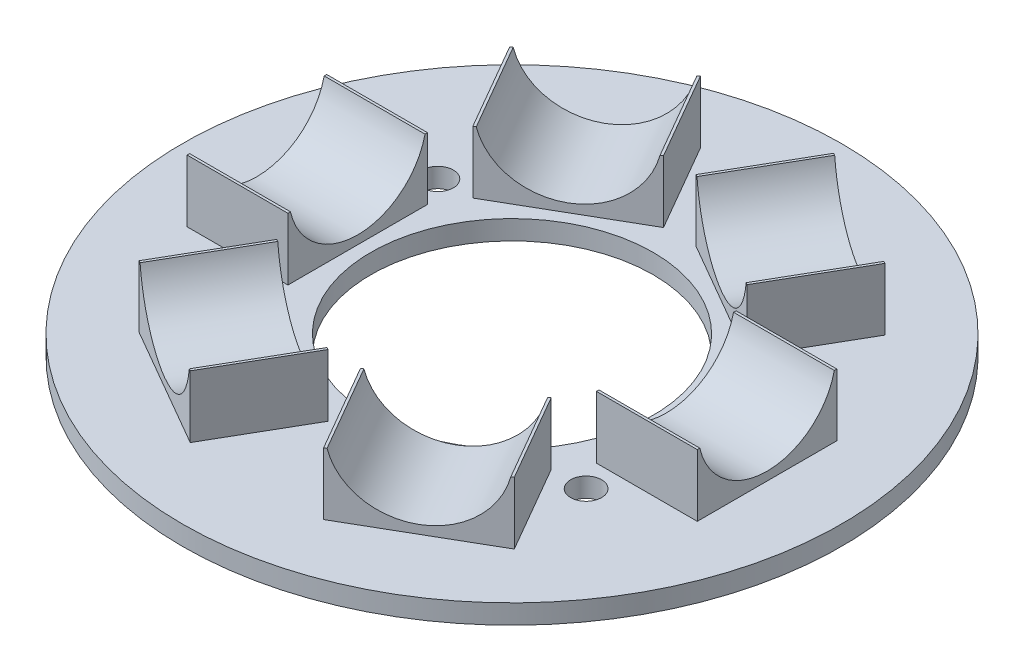
from build123d import *

# Parameters (mm, degrees)
SKETCH1_R           = 42.5
BOSS_EXTRUDE1_DEPTH = 2.5
SKETCH3_W           = 13
SKETCH3_H           = 18
BOSS_EXTRUDE2_DEPTH = 20
SKETCH4_R           = 8.9
CUT_EXTRUDE2_DEPTH  = 20
SKETCH5_R           = 8.9
CUT_EXTRUDE3_DEPTH  = 20
SKETCH6_R           = 8.9
CUT_EXTRUDE4_DEPTH  = 20
CUT_EXTRUDE5_START  = -20
SKETCH7_R           = 8.9
CUT_EXTRUDE5_DEPTH  = 20
CUT_EXTRUDE6_START  = -20
SKETCH8_R           = 8.9
CUT_EXTRUDE6_DEPTH  = 20
CUT_EXTRUDE7_START  = -20
SKETCH9_R           = 8.9
CUT_EXTRUDE7_DEPTH  = 20
CUT_EXTRUDE8_DEPTH  = 76.388
SKETCH11_W          = 71.811217628
SKETCH11_H          = 11.984599711
CUT_EXTRUDE9_DEPTH  = 76.388
SKETCH12_R          = 18.204170311
CUT_EXTRUDE10_DEPTH = 76.388
SKETCH13_R          = 1.997627935
CUT_EXTRUDE11_DEPTH = 10


with BuildPart() as part:
    # Sketch1 → Boss-Extrude1 (new body)
    with BuildSketch(Plane(origin=(0, 0, 0), x_dir=(1, 0, 0), z_dir=(0, 1, 0))):
        Circle(SKETCH1_R)
    extrude(amount=BOSS_EXTRUDE1_DEPTH)

    # Sketch3 → Boss-Extrude2 (add)
    with BuildSketch(Plane(origin=(0, 2.5, 0), x_dir=(1, 0, 0), z_dir=(0, 1, 0))):
        with Locations((-26.394376419, 0)):
            Rectangle(SKETCH3_W, SKETCH3_H)
        with Locations((26.394376419, 0)):
            Rectangle(SKETCH3_W, SKETCH3_H)
        Polygon((-8.599367677, 32.894541729), (-2.099367677, 21.63621148), (-17.687824945, 12.63621148), (-24.187824945, 23.894541729), align=None)
        Polygon((8.599367677, 32.894541729), (24.187824945, 23.894541729), (17.687824945, 12.63621148), (2.099367677, 21.63621148), align=None)
        Polygon((8.599367677, -32.894541729), (2.099367677, -21.63621148), (17.687824945, -12.63621148), (24.187824945, -23.894541729), align=None)
        Polygon((-8.599367677, -32.894541729), (-24.187824945, -23.894541729), (-17.687824945, -12.63621148), (-2.099367677, -21.63621148), align=None)
    extrude(amount=BOSS_EXTRUDE2_DEPTH)

    # Sketch4 → Cut-Extrude2 (cut)
    with BuildSketch(Plane.ZY.offset(32.894376419)):
        with Locations((0, 12.5)):
            Circle(SKETCH4_R)
    extrude(amount=-CUT_EXTRUDE2_DEPTH, mode=Mode.SUBTRACT)

    # Sketch5 → Cut-Extrude3 (cut)
    with BuildSketch(Plane(origin=(-16.393596311, 0, 28.394541729), x_dir=(0.8660254037844386, 0, 0.5000000000000003), z_dir=(-0.5000000000000003, 0, 0.8660254037844386))):
        with Locations((0, 12.5)):
            Circle(SKETCH5_R)
    extrude(amount=-CUT_EXTRUDE3_DEPTH, mode=Mode.SUBTRACT)

    # Sketch6 → Cut-Extrude4 (cut)
    with BuildSketch(Plane(origin=(16.393596311, 0, 28.394541729), x_dir=(0.8660254037844386, 0, -0.5000000000000003), z_dir=(0.5000000000000003, 0, 0.8660254037844386))):
        with Locations((0, 12.5)):
            Circle(SKETCH6_R)
    extrude(amount=-CUT_EXTRUDE4_DEPTH, mode=Mode.SUBTRACT)

    # Sketch7 → Cut-Extrude5 (cut)
    with BuildSketch(Plane(origin=(32.894376419, 0, 0), x_dir=(0, 0, -1), z_dir=(1, 0, 0)).offset(CUT_EXTRUDE5_START)):
        with Locations((0, 12.5)):
            Circle(SKETCH7_R)
    extrude(amount=CUT_EXTRUDE5_DEPTH, mode=Mode.SUBTRACT)

    # Sketch8 → Cut-Extrude6 (cut)
    with BuildSketch(Plane(origin=(16.393596311, 0, -28.394541729), x_dir=(-0.8660254037844386, 0, -0.5000000000000003), z_dir=(0.5000000000000003, 0, -0.8660254037844386)).offset(CUT_EXTRUDE6_START)):
        with Locations((0, 12.5)):
            Circle(SKETCH8_R)
    extrude(amount=CUT_EXTRUDE6_DEPTH, mode=Mode.SUBTRACT)

    # Sketch9 → Cut-Extrude7 (cut)
    with BuildSketch(Plane(origin=(-16.393596311, 0, -28.394541729), x_dir=(-0.8660254037844386, 0, 0.5000000000000003), z_dir=(-0.5000000000000003, 0, -0.8660254037844386)).offset(CUT_EXTRUDE7_START)):
        with Locations((0, 12.5)):
            Circle(SKETCH9_R)
    extrude(amount=CUT_EXTRUDE7_DEPTH, mode=Mode.SUBTRACT)

    # Sketch10 → Cut-Extrude8 (cut)
    with BuildSketch(Plane(origin=(-16.393596311, 0, -28.394541729), x_dir=(-0.8660254037844386, 0, 0.5000000000000003), z_dir=(-0.5000000000000003, 0, -0.8660254037844386))):
        Polygon((-35.669118209, 18.214643823), (-9, 18.214643823), (-9, 22.5), (9, 22.5), (9, 18.214643823), (33.747549551, 18.214643823), (33.747549551, 25.559573076), (-35.669118209, 25.559573076), align=None)
    extrude(amount=-CUT_EXTRUDE8_DEPTH, mode=Mode.SUBTRACT)

    # Sketch11 → Cut-Extrude9 (cut)
    with BuildSketch(Plane(origin=(-16.393596311, 0, -28.394541729), x_dir=(-0.8660254037844386, 0, 0.5000000000000003), z_dir=(-0.5000000000000003, 0, -0.8660254037844386))):
        with Locations((1.515702587, 16.507700144)):
            Rectangle(SKETCH11_W, SKETCH11_H)
    extrude(amount=-CUT_EXTRUDE9_DEPTH, mode=Mode.SUBTRACT)

    # Sketch12 → Cut-Extrude10 (cut)
    with BuildSketch(Plane(origin=(0, 2.5, 0), x_dir=(1, 0, 0), z_dir=(0, 1, 0))):
        Circle(SKETCH12_R)
    extrude(amount=-CUT_EXTRUDE10_DEPTH, mode=Mode.SUBTRACT)

    # Sketch13 → Cut-Extrude11 (cut)
    with BuildSketch(Plane(origin=(0, 2.5, 0), x_dir=(1, 0, 0), z_dir=(0, 1, 0))):
        with Locations((-22.072556502, 12.515367089)):
            Circle(SKETCH13_R)
        with Locations((22.072556502, 12.515367089)):
            Circle(SKETCH13_R)
        with Locations((22.072556502, -12.515367089)):
            Circle(SKETCH13_R)
        with Locations((-22.072556502, -12.515367089)):
            Circle(SKETCH13_R)
    extrude(amount=-CUT_EXTRUDE11_DEPTH, mode=Mode.SUBTRACT)


solid = part.part
